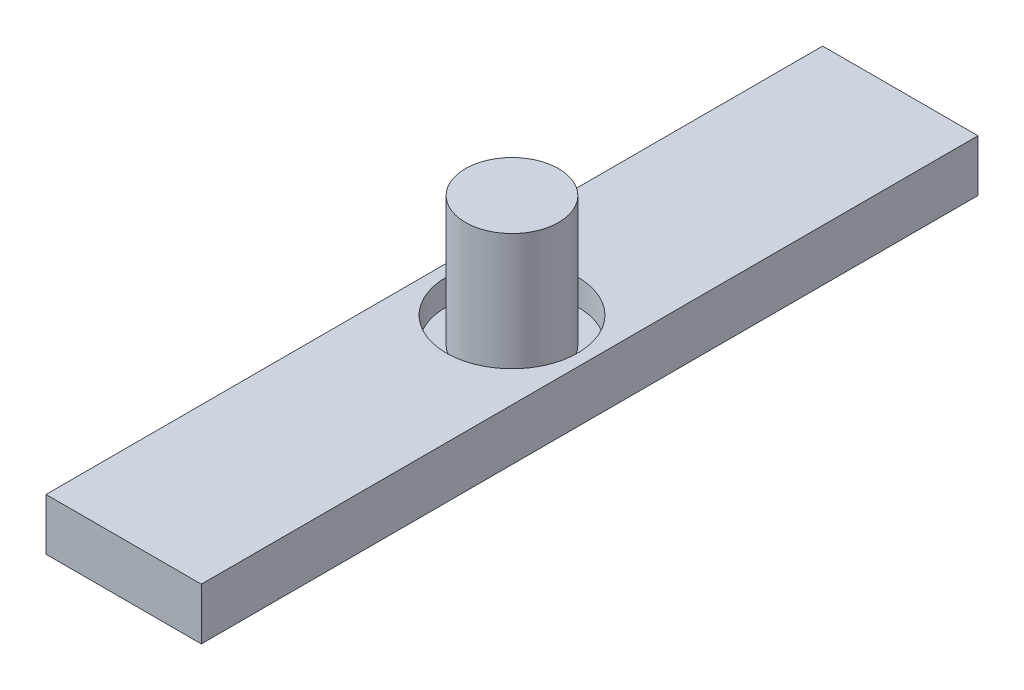
from build123d import *

# Parameters (mm, degrees)
SKETCH1_W           = 30
SKETCH1_H           = 150
BOSS_EXTRUDE2_DEPTH = 10
SKETCH3_R           = 12.7
SKETCH3_R_2         = 9
CUT_EXTRUDE1_DEPTH  = 5
BOSS_EXTRUDE3_START = 20
SKETCH4_R           = 9
BOSS_EXTRUDE3_DEPTH = 20


with BuildPart() as part:
    # Sketch1 → Boss-Extrude2 (new body)
    with BuildSketch(Plane(origin=(0, 0, 0), x_dir=(1, 0, 0), z_dir=(0, 1, 0))):
        with Locations((-4.813074205, -44.932862191)):
            Rectangle(SKETCH1_W, SKETCH1_H)
    extrude(amount=BOSS_EXTRUDE2_DEPTH)

    # Sketch3 → Cut-Extrude1 (cut)
    with BuildSketch(Plane(origin=(0, 10, 0), x_dir=(1, 0, 0), z_dir=(0, 1, 0))):
        with Locations(Location((-4.813074205, -44.932862191, 0), (0, 0, 270))):
            Circle(SKETCH3_R)
        with Locations(Location((-4.813074205, -44.932862191, 0), (0, 0, 270))):
            Circle(SKETCH3_R_2, mode=Mode.SUBTRACT)
    extrude(amount=-CUT_EXTRUDE1_DEPTH, mode=Mode.SUBTRACT)

    # Sketch4 → Boss-Extrude3 (add)
    with BuildSketch(Plane(origin=(0, 10, 0), x_dir=(1, 0, 0), z_dir=(0, 1, 0)).offset(BOSS_EXTRUDE3_START)):
        with Locations(Location((-4.813074205, -44.932862191, 0), (0, 0, 270))):
            Circle(SKETCH4_R)
    extrude(amount=-BOSS_EXTRUDE3_DEPTH)


solid = part.part
